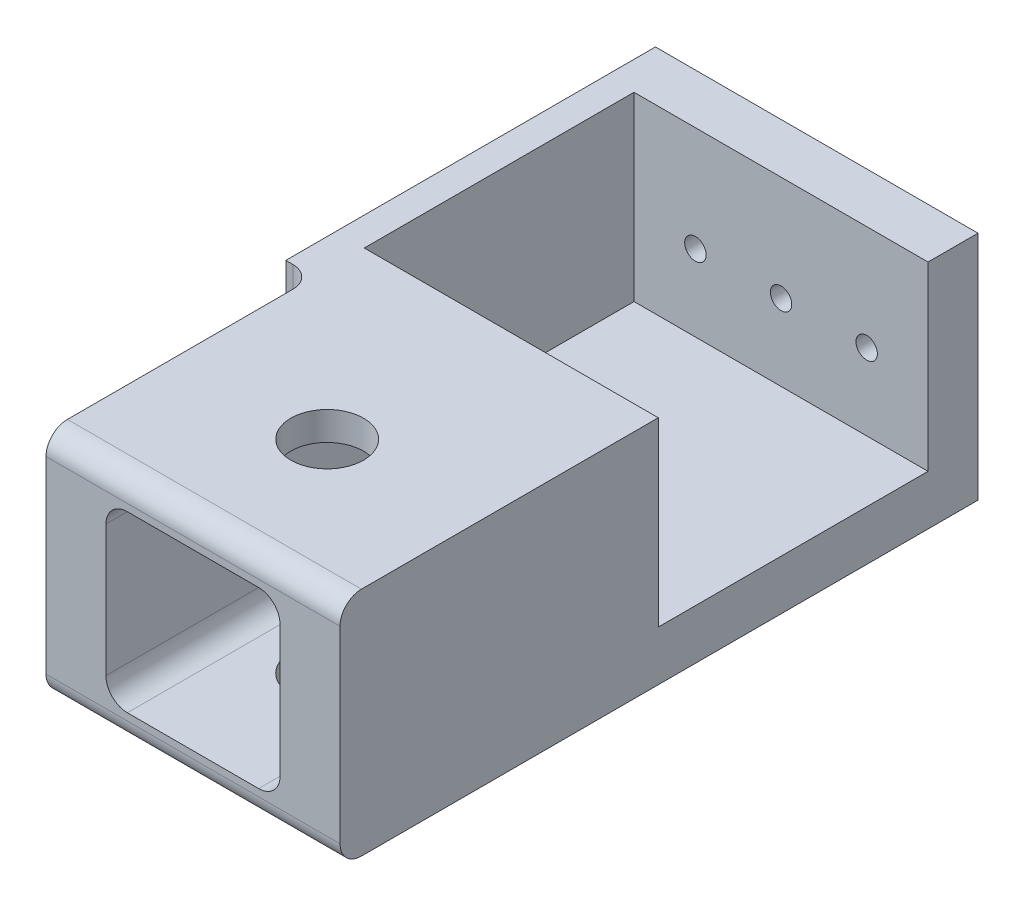
from build123d import *

# Parameters (mm, degrees)
SKETCH_1_W          = 18.8
SKETCH_1_H          = 3.5
EXTRUDE_1_DEPTH     = 12.7
EXTRUDE_1_2_DEPTH   = 12.7
SKETCH_2_W          = 18.8
SKETCH_2_H          = 25.9
EXTRUDE_2_DEPTH     = 3.5
EXTRUDE_3_DEPTH     = 1.8
SKETCH_4_W          = 25.9
SKETCH_4_H          = 16.2
EXTRUDE_4_DEPTH     = 2
SKETCH_5_W          = 20.6
SKETCH_5_H          = 16.2
EXTRUDE_5_DEPTH     = 18.8
SKETCH_6_W          = 12.2
SKETCH_6_H          = 12.2
CUT_EXTRUDE_1_DEPTH = 18.8
FILLET_1_R          = 1.5
SKETCH_7_R          = 2.55
CUT_EXTRUDE_2_DEPTH = 18.8
SKETCH_9_R          = 0.75
CUT_EXTRUDE_3_DEPTH = 7


with BuildPart() as part:
    # Эскиз1 → Бобышка-Вытянуть1 (new body)
    with BuildSketch(Plane(origin=(0, 0, 0), x_dir=(1, 0, 0), z_dir=(0, 1, 0))):
        with Locations((0, 11.2)):
            Rectangle(SKETCH_1_W, SKETCH_1_H)
    extrude(amount=EXTRUDE_1_DEPTH)



with BuildPart() as body_2:
    # Эскиз1 → Extrude 1 2 (new body)
    with BuildSketch(Plane(origin=(0, 0, 0), x_dir=(1, 0, 0), z_dir=(0, 1, 0))):
        with Locations((0, -11.2)):
            Rectangle(SKETCH_1_W, SKETCH_1_H)
    extrude(amount=EXTRUDE_1_2_DEPTH)


with BuildPart() as part_1:
    add(part.part)

    add(body_2.part)  # Бобышка-Вытянуть2 merges body 2
    # Эскиз2 → Бобышка-Вытянуть2 (add)
    with BuildSketch(Plane.XZ):
        Rectangle(SKETCH_2_W, SKETCH_2_H)
    extrude(amount=EXTRUDE_2_DEPTH)

    # Эскиз3 → Бобышка-Вытянуть3 (add)
    with BuildSketch(Plane.ZY.offset(9.4)):
        Polygon((-12.95, 12.7), (-12.95, -3.5), (12.95, -3.5), (12.95, 12.7), (9.45, 12.7), (9.45, 0), (-9.45, 0), (-9.45, 12.7), align=None)
    extrude(amount=EXTRUDE_3_DEPTH)

    # Эскиз4 → Бобышка-Вытянуть4 (add)
    with BuildSketch(Plane.ZY.offset(11.2)):
        with Locations((0, 4.6)):
            Rectangle(SKETCH_4_W, SKETCH_4_H)
    extrude(amount=EXTRUDE_4_DEPTH)

    # Эскиз5 → Бобышка-Вытянуть5 (add)
    with BuildSketch(Plane.XY.offset(12.95)):
        with Locations((-0.9, 4.6)):
            Rectangle(SKETCH_5_W, SKETCH_5_H)
    extrude(amount=EXTRUDE_5_DEPTH)

    # Эскиз6 → Вырез-Вытянуть1 (cut)
    with BuildSketch(Plane.XY.offset(31.75)):
        with Locations((-0.9, 4.6)):
            Rectangle(SKETCH_6_W, SKETCH_6_H)
    extrude(amount=-CUT_EXTRUDE_1_DEPTH, mode=Mode.SUBTRACT)

    # Скругление1
    fillet_1_edges = [part_1.edges().sort_by_distance(p)[0] for p in [
        (-11.2, 4.6, 12.95),
        (-0.9, -3.5, 31.75),
        (-0.9, 12.7, 31.75),
        (5.2, 10.7, 22.35),
        (5.2, -1.5, 22.35),
        (-7, -1.5, 22.35),
        (-7, 10.7, 22.35),
    ]]
    fillet(fillet_1_edges, radius=FILLET_1_R)

    # Эскиз7 → Вырез-Вытянуть2 (cut)
    with BuildSketch(Plane.XZ.offset(3.5)):
        with Locations(Location((-0.9, 22.35, 0), (0, 0, 90))):
            Circle(SKETCH_7_R)
    extrude(amount=-CUT_EXTRUDE_2_DEPTH, mode=Mode.SUBTRACT)

    # Эскиз9 → Вырез-Вытянуть3 (cut)
    with BuildSketch(Plane(origin=(0, 0, -12.95), x_dir=(-1, 0, 0), z_dir=(0, 0, -1))):
        with Locations((0.9, 5.35)):
            Circle(SKETCH_9_R)
        with Locations((6.9, 5.35)):
            Circle(SKETCH_9_R)
        with Locations((-5.1, 5.35)):
            Circle(SKETCH_9_R)
    extrude(amount=-CUT_EXTRUDE_3_DEPTH, mode=Mode.SUBTRACT)


solid = part_1.part
